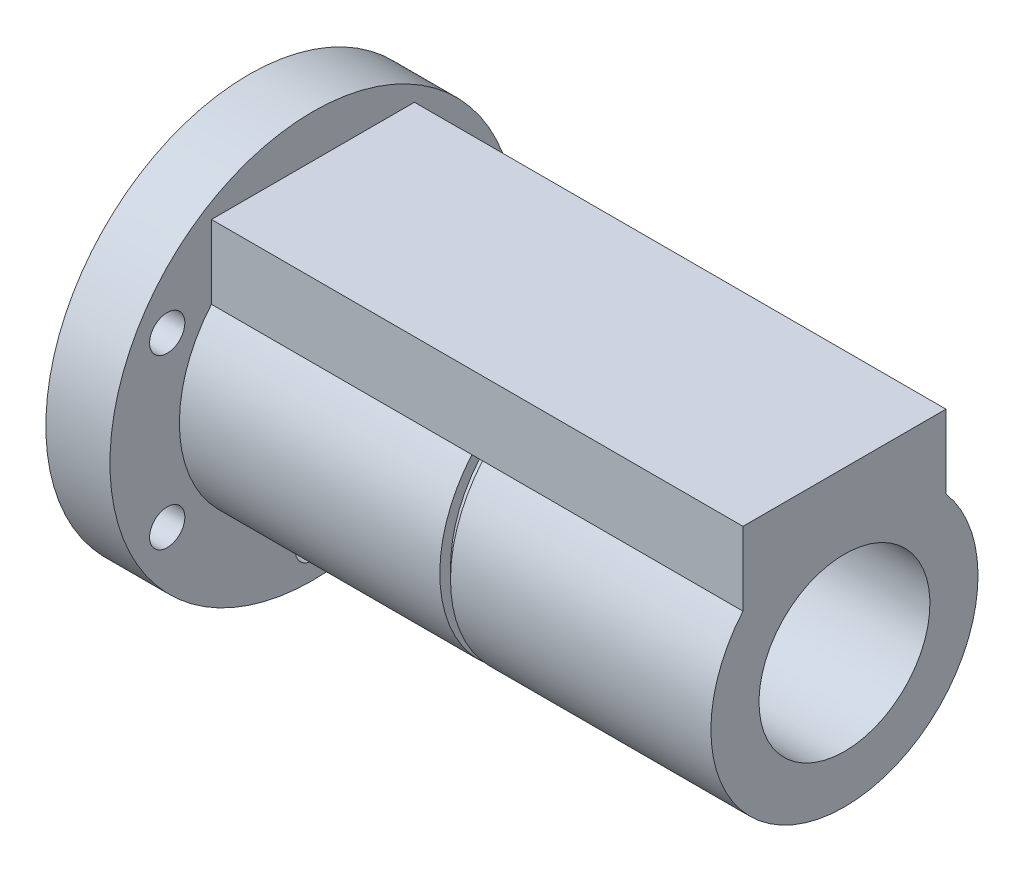
from build123d import *

# Parameters (mm, degrees)
CUT_EXTRUDE1_REACH  = 125.775
SKETCH2_R           = 3.3
SKETCH3_R           = 5.5
CUT_EXTRUDE2_DEPTH  = 6
CIRPATTERN1_COUNT   = 6
BOSS_EXTRUDE1_REACH = 125.775


with BuildPart() as part:
    # Sketch1 → Revolve1 (revolve)
    with BuildSketch(Plane.XY, mode=Mode.PRIVATE) as revolve1_sk:
        Polygon((-55.75, 38), (-43.75, 38), (-43.75, 25), (5, 25), (5, 23), (7, 23), (7, 25), (55.75, 25), (55.75, 16), (-55.75, 16), align=None)
    revolve(revolve1_sk.sketch.rotate(Axis((-82.106015927, 0, 0), (1, 0, 0)), 180), axis=Axis((-82.106015927, 0, 0), (1, 0, 0)))

    # Sketch2 → Cut-Extrude1 (cut, up to next)
    with BuildSketch(Plane.ZY.offset(55.75), mode=Mode.PRIVATE) as cut_extrude1_sk1:
        with Locations(Location((0, -31.5, 0), (0, 0, 270))):
            Circle(SKETCH2_R)
    cut_extrude1_tool1 = extrude(cut_extrude1_sk1.sketch, amount=-CUT_EXTRUDE1_REACH, mode=Mode.PRIVATE) & part.part
    cut_extrude1 = cut_extrude1_tool1.solids().sort_by_distance((-55.75, -31.5, 0))[0]
    add(cut_extrude1, mode=Mode.SUBTRACT)

    # Sketch3 → Cut-Extrude2 (cut)
    with BuildSketch(Plane.ZY.offset(55.75)):
        with Locations(Location((0, -31.5, 0), (0, 0, 270))):
            Circle(SKETCH3_R)
    cut_extrude2 = extrude(amount=-CUT_EXTRUDE2_DEPTH, mode=Mode.SUBTRACT)

    # CirPattern1: Cut-Extrude1, Cut-Extrude2 ×6 about axis, 1 skipped
    cirpattern1_axis = Axis((0, 0, 0), (-1, 0, 0))
    add([cut_extrude1.rotate(cirpattern1_axis, i * 360 / CIRPATTERN1_COUNT) for i in range(1, CIRPATTERN1_COUNT) if i not in (3,)], mode=Mode.SUBTRACT)
    add([cut_extrude2.rotate(cirpattern1_axis, i * 360 / CIRPATTERN1_COUNT) for i in range(1, CIRPATTERN1_COUNT) if i not in (3,)], mode=Mode.SUBTRACT)

    # Boss-Extrude1: up to this face of the body (flat: up to its plane)
    boss_extrude1_end = Plane(part.part.faces().sort_by_distance((-43.75, 36.925197693, 0))[0])
    # Sketch5 → Boss-Extrude1 (add, up to the picked face)
    with BuildSketch(Plane(origin=(55.75, 0, 0), x_dir=(0, 0, -1), z_dir=(1, 0, 0)), mode=Mode.PRIVATE) as boss_extrude1_sk1:
        with BuildLine():
            Line((-19, 30), (19, 30))
            Line((19, 30), (19, 16.248076809))
            ThreePointArc((19, 16.248076809), (0, 25), (-19, 16.248076809))
            Line((-19, 16.248076809), (-19, 30))
        make_face()
    boss_extrude1_tool1 = split(extrude(boss_extrude1_sk1.sketch, amount=-BOSS_EXTRUDE1_REACH, mode=Mode.PRIVATE), bisect_by=boss_extrude1_end, keep=Keep.BOTH, mode=Mode.PRIVATE)
    add(boss_extrude1_tool1.solids().sort_by(Axis((55.75, 25.748801, 0), (-1, 0, 0)))[0])


solid = part.part
